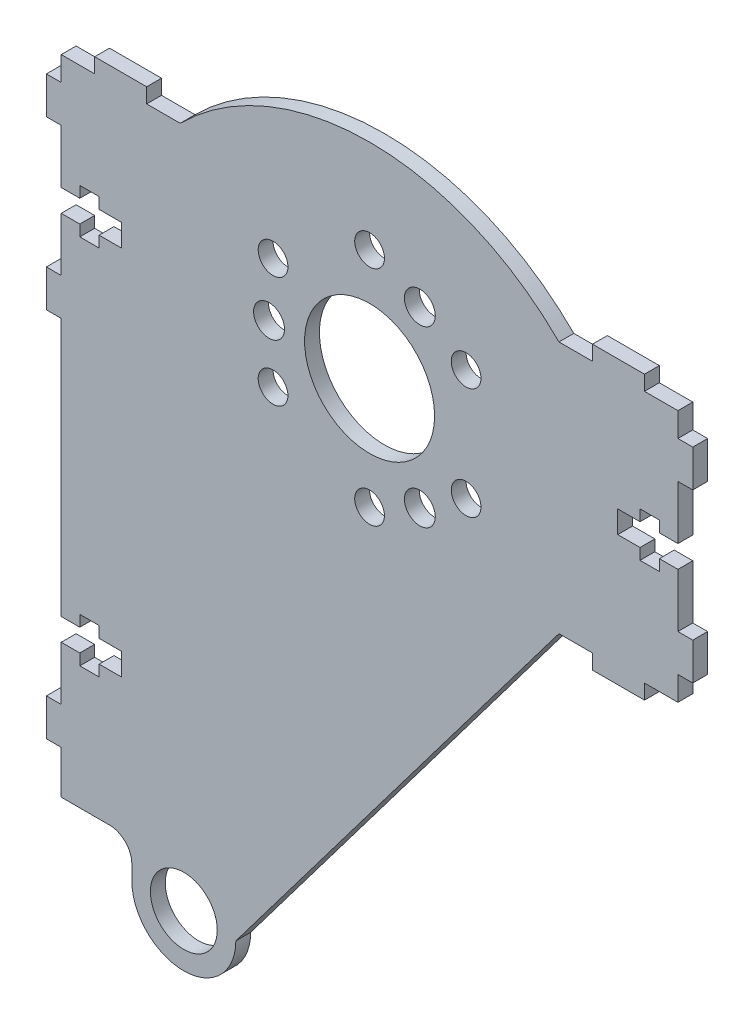
from build123d import *

# Parameters (mm, degrees)
SKETCH_1_R      = 2
SKETCH_1_R_2    = 2.08
SKETCH_1_R_3    = 8.75
SKETCH_1_R_4    = 4.5
EXTRUDE_2_DEPTH = 2


with BuildPart() as part:
    # 草图1 → 凸台-拉伸2 (new body)
    with BuildSketch(Plane.XY):
        with BuildLine():
            Line((41.5, 13.75), (41.5, 17))
            Line((41.5, 17), (37, 17))
            Line((37, 17), (37, 19))
            Line((37, 19), (30, 19))
            Line((30, 19), (30, 17))
            Line((30, 17), (25.488968202, 17))
            ThreePointArc((25.488968202, 17), (0, 27.55787632), (-25.488968202, 17))
            Line((-25.488968202, 17), (-30, 17))
            Line((-30, 17), (-30, 19))
            Line((-30, 19), (-37, 19))
            Line((-37, 19), (-37, 17))
            Line((-37, 17), (-41.5, 17))
            Line((-41.5, 17), (-41.5, 13.75))
            Line((-41.5, 13.75), (-43.5, 13.75))
            Line((-43.5, 13.75), (-43.5, 8.75))
            Line((-43.5, 8.75), (-41.5, 8.75))
            Line((-41.5, 8.75), (-41.5, 1.5))
            Line((-41.5, 1.5), (-39, 1.5))
            Line((-39, 1.5), (-39, 3))
            Line((-39, 3), (-36.4, 3))
            Line((-36.4, 3), (-36.4, 1.5))
            Line((-36.4, 1.5), (-33.4, 1.5))
            Line((-33.4, 1.5), (-33.4, -1.5))
            Line((-33.4, -1.5), (-36.4, -1.5))
            Line((-36.4, -1.5), (-36.4, -3))
            Line((-36.4, -3), (-39, -3))
            Line((-39, -3), (-39, -1.5))
            Line((-39, -1.5), (-41.5, -1.5))
            Line((-41.5, -1.5), (-41.5, -8.75))
            Line((-41.5, -8.75), (-43.5, -8.75))
            Line((-43.5, -8.75), (-43.5, -13.75))
            Line((-43.5, -13.75), (-41.5, -13.75))
            Line((-41.5, -13.75), (-41.5, -17))
            Line((-41.5, -17), (-41.5, -48.49787632))
            Line((-41.5, -48.49787632), (-39, -48.49787632))
            Line((-39, -48.49787632), (-39, -46.99787632))
            Line((-39, -46.99787632), (-36.4, -46.99787632))
            Line((-36.4, -46.99787632), (-36.4, -48.49787632))
            Line((-36.4, -48.49787632), (-33.4, -48.49787632))
            Line((-33.4, -48.49787632), (-33.4, -51.49787632))
            Line((-33.4, -51.49787632), (-36.4, -51.49787632))
            Line((-36.4, -51.49787632), (-36.4, -52.99787632))
            Line((-36.4, -52.99787632), (-39, -52.99787632))
            Line((-39, -52.99787632), (-39, -51.49787632))
            Line((-39, -51.49787632), (-41.5, -51.49787632))
            Line((-41.5, -51.49787632), (-41.5, -58.74787632))
            Line((-41.5, -58.74787632), (-43.5, -58.74787632))
            Line((-43.5, -58.74787632), (-43.5, -63.74787632))
            Line((-43.5, -63.74787632), (-41.5, -63.74787632))
            Line((-41.5, -63.74787632), (-41.5, -69.55787632))
            Line((-41.5, -69.55787632), (-35, -69.55787632))
            ThreePointArc((-35, -69.55787632), (-32.878679656, -70.436555977), (-32, -72.55787632))
            Line((-32, -72.55787632), (-32, -74.55787632))
            ThreePointArc((-32, -74.55787632), (-25, -81.55787632), (-18, -74.55787632))
            Line((-18, -74.55787632), (25.488968202, -17))
            Line((25.488968202, -17), (30, -17))
            Line((30, -17), (30, -19))
            Line((30, -19), (37, -19))
            Line((37, -19), (37, -17))
            Line((37, -17), (41.5, -17))
            Line((41.5, -17), (41.5, -13.75))
            Line((41.5, -13.75), (43.5, -13.75))
            Line((43.5, -13.75), (43.5, -8.75))
            Line((43.5, -8.75), (41.5, -8.75))
            Line((41.5, -8.75), (41.5, -1.5))
            Line((41.5, -1.5), (39, -1.5))
            Line((39, -1.5), (39, -3))
            Line((39, -3), (36.4, -3))
            Line((36.4, -3), (36.4, -1.5))
            Line((36.4, -1.5), (33.4, -1.5))
            Line((33.4, -1.5), (33.4, 1.5))
            Line((33.4, 1.5), (36.4, 1.5))
            Line((36.4, 1.5), (36.4, 3))
            Line((36.4, 3), (39, 3))
            Line((39, 3), (39, 1.5))
            Line((39, 1.5), (41.5, 1.5))
            Line((41.5, 1.5), (41.5, 8.75))
            Line((41.5, 8.75), (43.5, 8.75))
            Line((43.5, 8.75), (43.5, 13.75))
            Line((43.5, 13.75), (41.5, 13.75))
        make_face()
        with Locations((0, -15)):
            Circle(SKETCH_1_R, mode=Mode.SUBTRACT)
        with Locations((-12.990381057, -7.5)):
            Circle(SKETCH_1_R, mode=Mode.SUBTRACT)
        with Locations((-12.990381057, 7.5)):
            Circle(SKETCH_1_R, mode=Mode.SUBTRACT)
        with Locations((0, 15)):
            Circle(SKETCH_1_R, mode=Mode.SUBTRACT)
        with Locations((12.990381057, 7.5)):
            Circle(SKETCH_1_R, mode=Mode.SUBTRACT)
        with Locations((12.990381057, -7.5)):
            Circle(SKETCH_1_R, mode=Mode.SUBTRACT)
        with Locations((-13.53, 0)):
            Circle(SKETCH_1_R_2, mode=Mode.SUBTRACT)
        with Locations((6.765, 11.717323713)):
            Circle(SKETCH_1_R_2, mode=Mode.SUBTRACT)
        with Locations((6.765, -11.717323713)):
            Circle(SKETCH_1_R_2, mode=Mode.SUBTRACT)
        Circle(SKETCH_1_R_3, mode=Mode.SUBTRACT)
        with Locations((-25, -74.55787632)):
            Circle(SKETCH_1_R_4, mode=Mode.SUBTRACT)
    extrude(amount=EXTRUDE_2_DEPTH)


solid = part.part
